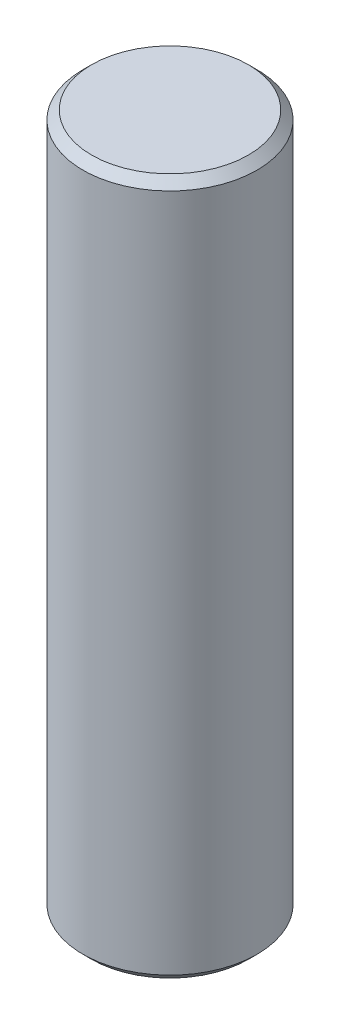
from build123d import *

# Parameters (mm, degrees)
SKETCH1_W     = 5
SKETCH1_H     = 40
CHAMFER1_SIZE = 0.5


with BuildPart() as part:
    # Sketch1 → Revolve1 (revolve)
    with BuildSketch(Plane.XY):
        with Locations((2.5, 20)):
            Rectangle(SKETCH1_W, SKETCH1_H)
    revolve(axis=Axis((0, 0, 0), (0, 1, 0)))

    # Chamfer1
    chamfer1_edges = [part.edges().sort_by_distance(p)[0] for p in [
        (-5, 40, 0),
        (-5, 0, 0),
    ]]
    chamfer(chamfer1_edges, length=CHAMFER1_SIZE)


solid = part.part
